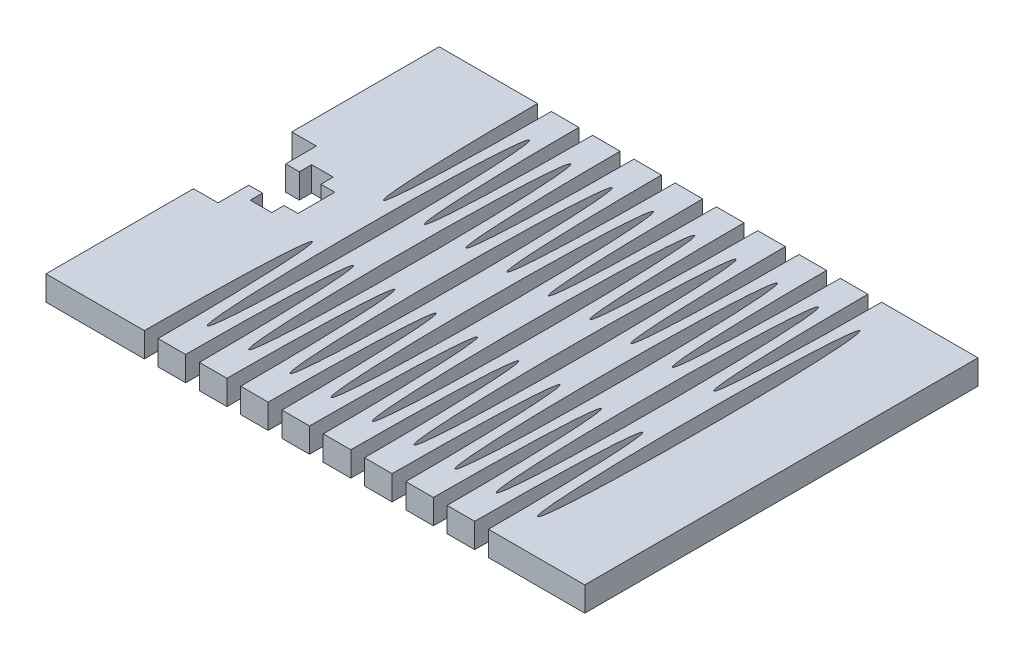
from build123d import *

# Parameters (mm, degrees)
SKETCH1_RX          = 20.79625
SKETCH1_RY          = 0.9525
BOSS_EXTRUDE1_DEPTH = 3.175


with BuildPart() as part:
    # Sketch1 → Boss-Extrude1 (new body)
    with BuildSketch(Plane(origin=(0, 0, 0), x_dir=(1, 0, 0), z_dir=(0, 1, 0))):
        with BuildLine():
            Line((0, 19.05), (3.175, 19.05))
            Line((3.175, 19.05), (3.175, 23.01875))
            Line((3.175, 23.01875), (4.953, 23.01875))
            Line((4.953, 23.01875), (4.953, 21.43125))
            Line((4.953, 21.43125), (7.731125, 21.43125))
            Line((7.731125, 21.43125), (7.731125, 23.01875))
            Line((7.731125, 23.01875), (9.525, 23.01875))
            Line((9.525, 23.01875), (9.525, 27.78125))
            Line((9.525, 27.78125), (7.731125, 27.78125))
            Line((7.731125, 27.78125), (7.731125, 29.36875))
            Line((7.731125, 29.36875), (4.953, 29.36875))
            Line((4.953, 29.36875), (4.953, 27.78125))
            Line((4.953, 27.78125), (3.175, 27.78125))
            Line((3.175, 27.78125), (3.175, 31.75))
            Line((3.175, 31.75), (0, 31.75))
            Line((0, 31.75), (0, 50.8))
            Line((0, 50.8), (12.7, 50.8))
            add(Edge.make_bspline(
                [(12.7, 50.8), (12.7, 30.00375), (13.589, 30.00375), (14.478, 30.00375), (14.478, 50.8)],
                knots=[1.570796327, 1.570796327, 1.570796327, 3.141592654, 3.141592654, 4.71238898, 4.71238898, 4.71238898], degree=2, weights=[1, 0.707106781, 1, 0.707106781, 1]))
            Line((14.478, 50.8), (18.034, 50.8))
            add(Edge.make_bspline(
                [(18.034, 50.8), (18.034, 30.00375), (18.923, 30.00375), (19.812, 30.00375), (19.812, 50.8)],
                knots=[1.570796327, 1.570796327, 1.570796327, 3.141592654, 3.141592654, 4.71238898, 4.71238898, 4.71238898], degree=2, weights=[1, 0.707106781, 1, 0.707106781, 1]))
            Line((19.812, 50.8), (23.368, 50.8))
            add(Edge.make_bspline(
                [(23.368, 50.8), (23.368, 30.00375), (24.257, 30.00375), (25.146, 30.00375), (25.146, 50.8)],
                knots=[4.71238898, 4.71238898, 4.71238898, 6.283185307, 6.283185307, 7.853981634, 7.853981634, 7.853981634], degree=2, weights=[1, 0.707106781, 1, 0.707106781, 1]))
            Line((25.146, 50.8), (28.702, 50.8))
            add(Edge.make_bspline(
                [(28.702, 50.8), (28.702, 30.00375), (29.591, 30.00375), (30.48, 30.00375), (30.48, 50.8)],
                knots=[4.71238898, 4.71238898, 4.71238898, 6.283185307, 6.283185307, 7.853981634, 7.853981634, 7.853981634], degree=2, weights=[1, 0.707106781, 1, 0.707106781, 1]))
            Line((30.48, 50.8), (34.036, 50.8))
            add(Edge.make_bspline(
                [(34.036, 50.8), (34.036, 30.00375), (34.925, 30.00375), (35.814, 30.00375), (35.814, 50.8)],
                knots=[4.71238898, 4.71238898, 4.71238898, 6.283185307, 6.283185307, 7.853981634, 7.853981634, 7.853981634], degree=2, weights=[1, 0.707106781, 1, 0.707106781, 1]))
            Line((35.814, 50.8), (39.37, 50.8))
            add(Edge.make_bspline(
                [(39.37, 50.8), (39.37, 30.00375), (40.259, 30.00375), (41.148, 30.00375), (41.148, 50.8)],
                knots=[4.71238898, 4.71238898, 4.71238898, 6.283185307, 6.283185307, 7.853981634, 7.853981634, 7.853981634], degree=2, weights=[1, 0.707106781, 1, 0.707106781, 1]))
            Line((41.148, 50.8), (44.704, 50.8))
            add(Edge.make_bspline(
                [(44.704, 50.8), (44.704, 30.00375), (45.593, 30.00375), (46.482, 30.00375), (46.482, 50.8)],
                knots=[4.71238898, 4.71238898, 4.71238898, 6.283185307, 6.283185307, 7.853981634, 7.853981634, 7.853981634], degree=2, weights=[1, 0.707106781, 1, 0.707106781, 1]))
            Line((46.482, 50.8), (50.038, 50.8))
            add(Edge.make_bspline(
                [(50.038, 50.8), (50.038, 30.00375), (50.927, 30.00375), (51.816, 30.00375), (51.816, 50.8)],
                knots=[1.570796327, 1.570796327, 1.570796327, 3.141592654, 3.141592654, 4.71238898, 4.71238898, 4.71238898], degree=2, weights=[1, 0.707106781, 1, 0.707106781, 1]))
            Line((51.816, 50.8), (55.372, 50.8))
            add(Edge.make_bspline(
                [(55.372, 50.8), (55.372, 30.00375), (56.261, 30.00375), (57.15, 30.00375), (57.15, 50.8)],
                knots=[1.570796327, 1.570796327, 1.570796327, 3.141592654, 3.141592654, 4.71238898, 4.71238898, 4.71238898], degree=2, weights=[1, 0.707106781, 1, 0.707106781, 1]))
            Line((57.15, 50.8), (60.706, 50.8))
            Line((60.706, 50.8), (69.596, 50.8))
            Line((69.596, 50.8), (69.596, 0))
            Line((69.596, 0), (60.706, 0))
            Line((60.706, 0), (57.15, 0))
            add(Edge.make_bspline(
                [(57.15, 0), (57.15, 20.79625), (56.261, 20.79625), (55.372, 20.79625), (55.372, 0)],
                knots=[4.71238898, 4.71238898, 4.71238898, 6.283185307, 6.283185307, 7.853981634, 7.853981634, 7.853981634], degree=2, weights=[1, 0.707106781, 1, 0.707106781, 1]))
            Line((55.372, 0), (51.816, 0))
            add(Edge.make_bspline(
                [(51.816, 0), (51.816, 20.79625), (50.927, 20.79625), (50.038, 20.79625), (50.038, 0)],
                knots=[4.71238898, 4.71238898, 4.71238898, 6.283185307, 6.283185307, 7.853981634, 7.853981634, 7.853981634], degree=2, weights=[1, 0.707106781, 1, 0.707106781, 1]))
            Line((50.038, 0), (46.482, 0))
            add(Edge.make_bspline(
                [(46.482, 0), (46.482, 20.79625), (45.593, 20.79625), (44.704, 20.79625), (44.704, 0)],
                knots=[4.71238898, 4.71238898, 4.71238898, 6.283185307, 6.283185307, 7.853981634, 7.853981634, 7.853981634], degree=2, weights=[1, 0.707106781, 1, 0.707106781, 1]))
            Line((44.704, 0), (41.148, 0))
            add(Edge.make_bspline(
                [(41.148, 0), (41.148, 20.79625), (40.259, 20.79625), (39.37, 20.79625), (39.37, 0)],
                knots=[4.71238898, 4.71238898, 4.71238898, 6.283185307, 6.283185307, 7.853981634, 7.853981634, 7.853981634], degree=2, weights=[1, 0.707106781, 1, 0.707106781, 1]))
            Line((39.37, 0), (35.814, 0))
            add(Edge.make_bspline(
                [(35.814, 0), (35.814, 20.79625), (34.925, 20.79625), (34.036, 20.79625), (34.036, 0)],
                knots=[4.71238898, 4.71238898, 4.71238898, 6.283185307, 6.283185307, 7.853981634, 7.853981634, 7.853981634], degree=2, weights=[1, 0.707106781, 1, 0.707106781, 1]))
            Line((34.036, 0), (30.48, 0))
            add(Edge.make_bspline(
                [(30.48, 0), (30.48, 20.79625), (29.591, 20.79625), (28.702, 20.79625), (28.702, 0)],
                knots=[4.71238898, 4.71238898, 4.71238898, 6.283185307, 6.283185307, 7.853981634, 7.853981634, 7.853981634], degree=2, weights=[1, 0.707106781, 1, 0.707106781, 1]))
            Line((28.702, 0), (25.146, 0))
            add(Edge.make_bspline(
                [(25.146, 0), (25.146, 20.79625), (24.257, 20.79625), (23.368, 20.79625), (23.368, 0)],
                knots=[4.71238898, 4.71238898, 4.71238898, 6.283185307, 6.283185307, 7.853981634, 7.853981634, 7.853981634], degree=2, weights=[1, 0.707106781, 1, 0.707106781, 1]))
            Line((23.368, 0), (19.812, 0))
            add(Edge.make_bspline(
                [(19.812, 0), (19.812, 20.79625), (18.923, 20.79625), (18.034, 20.79625), (18.034, 0)],
                knots=[4.71238898, 4.71238898, 4.71238898, 6.283185307, 6.283185307, 7.853981634, 7.853981634, 7.853981634], degree=2, weights=[1, 0.707106781, 1, 0.707106781, 1]))
            Line((18.034, 0), (14.478, 0))
            add(Edge.make_bspline(
                [(14.478, 0), (14.478, 20.79625), (13.589, 20.79625), (12.7, 20.79625), (12.7, 0)],
                knots=[4.71238898, 4.71238898, 4.71238898, 6.283185307, 6.283185307, 7.853981634, 7.853981634, 7.853981634], degree=2, weights=[1, 0.707106781, 1, 0.707106781, 1]))
            Line((12.7, 0), (0, 0))
            Line((0, 0), (0, 19.05))
        make_face()
        with Locations(Location((16.256, 25.4), (0, 0, -90))):
            Ellipse(SKETCH1_RX, SKETCH1_RY, mode=Mode.SUBTRACT)
        with Locations(Location((21.59, 25.4), (0, 0, -90))):
            Ellipse(SKETCH1_RX, SKETCH1_RY, mode=Mode.SUBTRACT)
        with Locations(Location((26.924, 25.4), (0, 0, -90))):
            Ellipse(SKETCH1_RX, SKETCH1_RY, mode=Mode.SUBTRACT)
        with Locations(Location((32.258, 25.4), (0, 0, -90))):
            Ellipse(SKETCH1_RX, SKETCH1_RY, mode=Mode.SUBTRACT)
        with Locations(Location((37.592, 25.4), (0, 0, -90))):
            Ellipse(SKETCH1_RX, SKETCH1_RY, mode=Mode.SUBTRACT)
        with Locations(Location((42.926, 25.4), (0, 0, -90))):
            Ellipse(SKETCH1_RX, SKETCH1_RY, mode=Mode.SUBTRACT)
        with Locations(Location((48.26, 25.4), (0, 0, -90))):
            Ellipse(SKETCH1_RX, SKETCH1_RY, mode=Mode.SUBTRACT)
        with Locations(Location((53.594, 25.4), (0, 0, -90))):
            Ellipse(SKETCH1_RX, SKETCH1_RY, mode=Mode.SUBTRACT)
        with Locations(Location((58.928, 25.4), (0, 0, -90))):
            Ellipse(SKETCH1_RX, SKETCH1_RY, mode=Mode.SUBTRACT)
    extrude(amount=BOSS_EXTRUDE1_DEPTH)


solid = part.part
